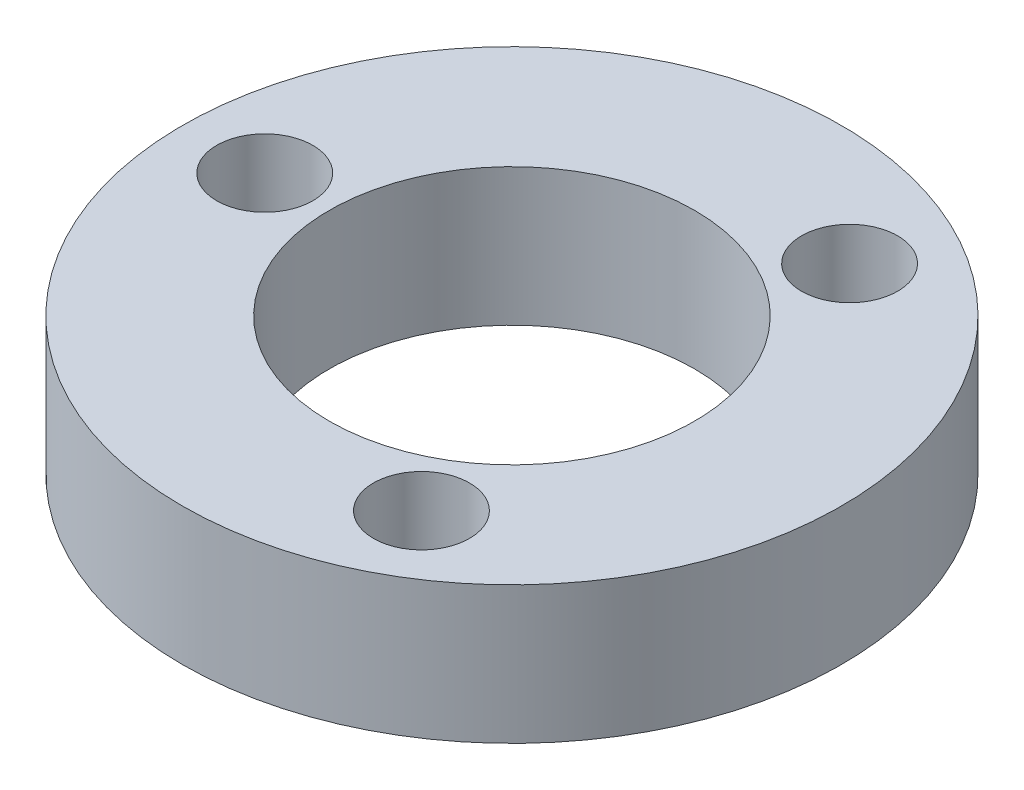
from build123d import *

# Parameters (mm, degrees)
SKETCH_1_R      = 12
SKETCH_1_R_2    = 6.65
SKETCH_1_R_3    = 1.75
EXTRUDE_1_DEPTH = 5


with BuildPart() as part:
    # Эскиз1 → Бобышка-Вытянуть1 (new body)
    with BuildSketch(Plane(origin=(0, 0, 0), x_dir=(1, 0, 0), z_dir=(0, 1, 0))):
        with Locations(Location((0, 0, 0), (0, 0, 270))):
            Circle(SKETCH_1_R)
        with Locations(Location((0, 0, 0), (0, 0, 270))):
            Circle(SKETCH_1_R_2, mode=Mode.SUBTRACT)
        with Locations(Location((-9, 0, 0), (0, 0, 270))):
            Circle(SKETCH_1_R_3, mode=Mode.SUBTRACT)
        with Locations(Location((4.5, 7.794228634, 0), (0, 0, 270))):
            Circle(SKETCH_1_R_3, mode=Mode.SUBTRACT)
        with Locations(Location((4.5, -7.794228634, 0), (0, 0, 270))):
            Circle(SKETCH_1_R_3, mode=Mode.SUBTRACT)
    extrude(amount=EXTRUDE_1_DEPTH)


solid = part.part
